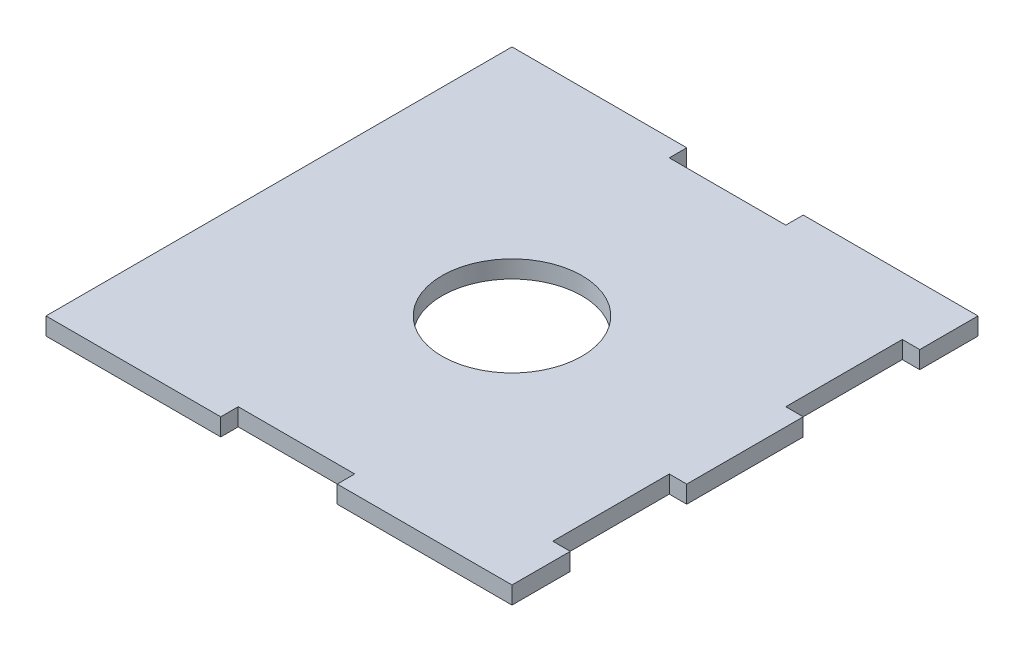
from build123d import *

# Parameters (mm, degrees)
CROQUIS1_R              = 12
SALIENTE_EXTRUIR1_DEPTH = 3


with BuildPart() as part:
    # Croquis1 → Saliente-Extruir1 (new body)
    with BuildSketch(Plane(origin=(0, 0, 0), x_dir=(1, 0, 0), z_dir=(0, 1, 0))):
        Polygon((-40, 40), (-10, 40), (-10, 37), (0, 37), (10, 37), (10, 40), (37, 40), (40, 40), (40, 30), (37, 30), (37, 10), (40, 10), (40, -10), (37, -10), (37, -30), (40, -30), (40, -40), (37, -40), (10, -40), (10, -37), (0, -37), (-10, -37), (-10, -40), (-40, -40), align=None)
        with Locations(Location((0, 0, 0), (0, 0, 270))):
            Circle(CROQUIS1_R, mode=Mode.SUBTRACT)
    extrude(amount=SALIENTE_EXTRUIR1_DEPTH)


solid = part.part
